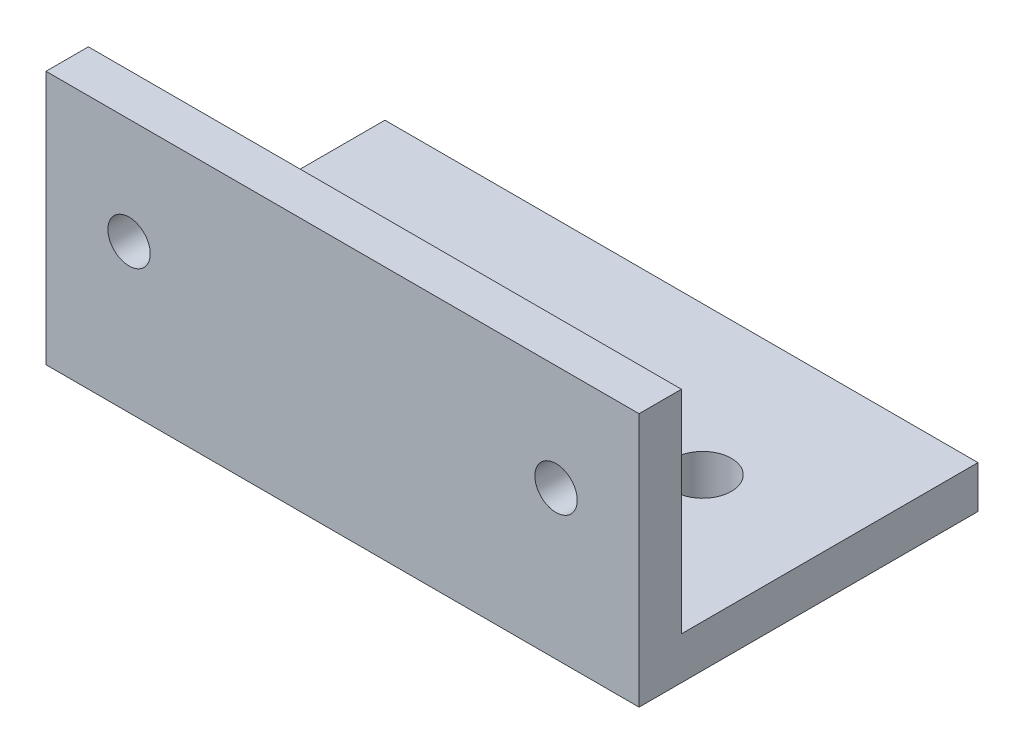
from build123d import *

# Parameters (mm, degrees)
BOSS_EXTRUDE1_DEPTH = 44.45
SKETCH3_R           = 1.5875
CUT_EXTRUDE1_DEPTH  = 25.4
CUT_EXTRUDE2_DEPTH  = 25.4


with BuildPart() as part:
    # Sketch1 → Boss-Extrude1 (new body)
    with BuildSketch(Plane(origin=(0, 0, 0), x_dir=(0, 0, -1), z_dir=(1, 0, 0))):
        Polygon((0, 19.05), (0, 0), (25.4, 0), (25.4, 3.175), (3.175, 3.175), (3.175, 19.05), align=None)
    extrude(amount=BOSS_EXTRUDE1_DEPTH)

    # Sketch3 → Cut-Extrude1 (cut)
    with BuildSketch(Plane(origin=(0, 0, -3.175), x_dir=(-1, 0, 0), z_dir=(0, 0, -1))):
        with Locations(Location((-38.225, 11.1125, 0), (0, 0, 90))):
            Circle(SKETCH3_R)
        with Locations(Location((-6.225, 11.1125, 0), (0, 0, 90))):
            Circle(SKETCH3_R)
    extrude(amount=-CUT_EXTRUDE1_DEPTH, mode=Mode.SUBTRACT)

    # Sketch4 → Cut-Extrude2 (cut)
    with BuildSketch(Plane(origin=(0, 3.175, 0), x_dir=(1, 0, 0), z_dir=(0, 1, 0))):
        with BuildLine():
            ThreePointArc((37.07765, 14.2875), (34.925, 16.44015), (32.77235, 14.2875))
            Line((32.77235, 14.2875), (34.925, 14.2875))
            Line((34.925, 14.2875), (37.07765, 14.2875))
        make_face()
        with BuildLine():
            Line((34.925, 14.2875), (32.77235, 14.2875))
            ThreePointArc((32.77235, 14.2875), (34.925, 12.13485), (37.07765, 14.2875))
            Line((37.07765, 14.2875), (34.925, 14.2875))
        make_face()
        with BuildLine():
            Line((7.37235, 14.2875), (9.525, 14.2875))
            Line((9.525, 14.2875), (11.67765, 14.2875))
            ThreePointArc((11.67765, 14.2875), (9.525, 16.44015), (7.37235, 14.2875))
        make_face()
        with BuildLine():
            Line((11.67765, 14.2875), (9.525, 14.2875))
            Line((9.525, 14.2875), (7.37235, 14.2875))
            ThreePointArc((7.37235, 14.2875), (9.525, 12.13485), (11.67765, 14.2875))
        make_face()
    extrude(amount=-CUT_EXTRUDE2_DEPTH, mode=Mode.SUBTRACT)


solid = part.part
